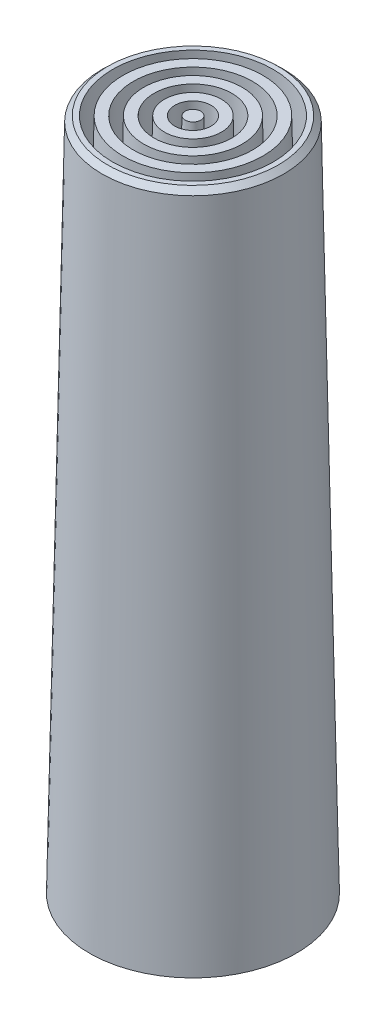
from build123d import *

# Parameters (mm, degrees)
CHAMFER1_SIZE  = 1
CHAMFER1_SIZE2 = 1.019796363


with BuildPart() as part:
    # Sketch1 → Revolve1 (revolve)
    with BuildSketch(Plane.XY, mode=Mode.PRIVATE) as revolve1_sk:
        Polygon((0, 0), (20, 0), (17.5, 130), (0, 130), align=None)
    revolve(revolve1_sk.sketch.rotate(Axis((0, 130, 0), (0, -1, 0)), 180), axis=Axis((0, 130, 0), (0, -1, 0)))

    # Sketch2 → Cut-Revolve1 (revolve, cut)
    with BuildSketch(Plane.XY):
        Polygon((15.999260423, 0), (13.499260423, 130), (15.499630212, 130), (17.999630212, 0), align=None)
        Polygon((13.998890635, 0), (11.498890635, 130), (9.498520847, 130), (11.998520847, 0), align=None)
        Polygon((9.998151059, 0), (7.498151059, 130), (5.49778127, 130), (7.99778127, 0), align=None)
        Polygon((5.997411482, 0), (3.497411482, 130), (1.497041694, 130), (3.997041694, 0), align=None)
    revolve(axis=Axis((0, 0, 0), (0, 1, 0)), mode=Mode.SUBTRACT)


with BuildPart() as cut_revolve1_piece_1:
    # of the separate pieces the step leaves, piece 1, a body of its own (cut_revolve1_pieces)
    add(part.part.solids().sort_by_distance((-20, 0, 0))[0])

    # Chamfer1
    chamfer1_edges = [cut_revolve1_piece_1.edges().sort_by_distance(p)[0] for p in [
        (17.5, 130, 0),
    ]]
    chamfer1_side = [cut_revolve1_piece_1.faces().sort_by_distance(p)[0] for p in [
        (18.75, 65, 0),
    ]]
    chamfer(chamfer1_edges, length=CHAMFER1_SIZE, length2=CHAMFER1_SIZE2, reference=chamfer1_side[0])


with BuildPart() as cut_revolve1_piece_2:
    # of the separate pieces the step leaves, piece 2, a body of its own (cut_revolve1_pieces)
    add(part.part.solids().sort_by_distance((15.999260423, 0, 0))[0])


with BuildPart() as cut_revolve1_piece_3:
    # of the separate pieces the step leaves, piece 3, a body of its own (cut_revolve1_pieces)
    add(part.part.solids().sort_by_distance((11.998520847, 0, 0))[0])


with BuildPart() as cut_revolve1_piece_4:
    # of the separate pieces the step leaves, piece 4, a body of its own (cut_revolve1_pieces)
    add(part.part.solids().sort_by_distance((7.99778127, 0, 0))[0])


with BuildPart() as cut_revolve1_piece_5:
    # of the separate pieces the step leaves, piece 5, a body of its own (cut_revolve1_pieces)
    add(part.part.solids().sort_by_distance((3.997041694, 0, 0))[0])


solid = Compound([cut_revolve1_piece_1.part, cut_revolve1_piece_2.part, cut_revolve1_piece_3.part, cut_revolve1_piece_4.part, cut_revolve1_piece_5.part])
